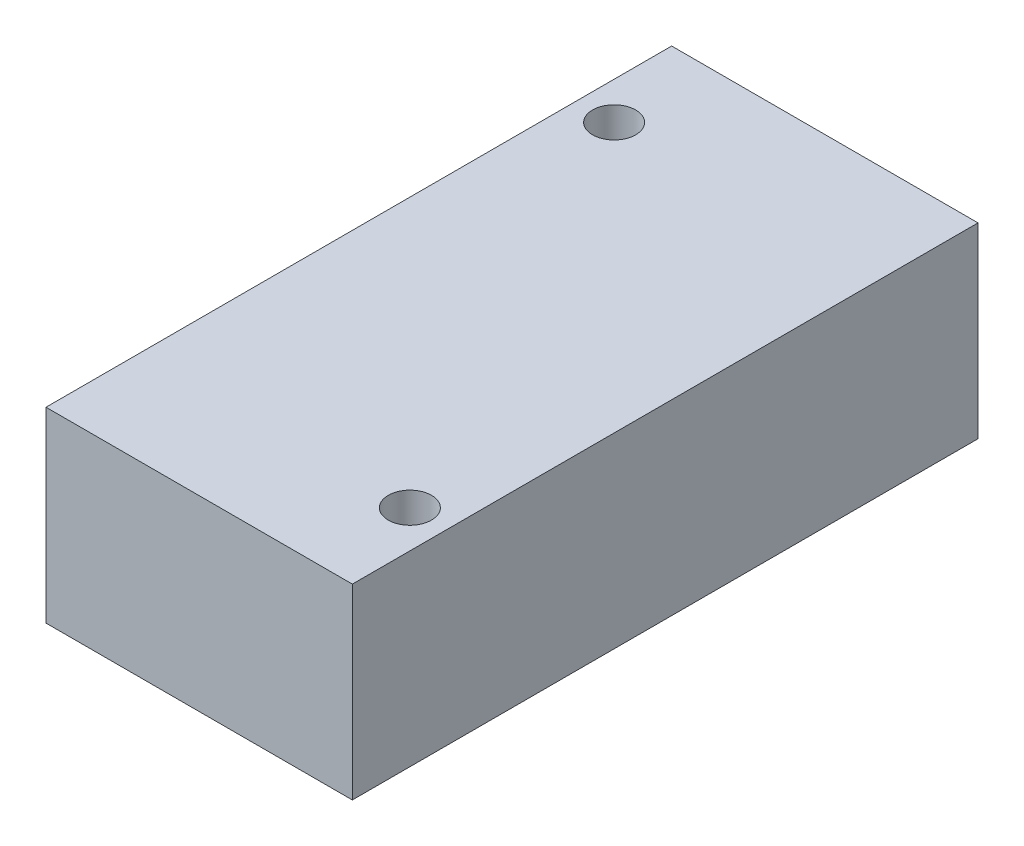
from build123d import *

# Parameters (mm, degrees)
SKETCH_1_W      = 21.3
SKETCH_1_H      = 43.5
SKETCH_1_R      = 1.5
EXTRUDE_1_DEPTH = 13


with BuildPart() as part:
    # 草图1 → 凸台-拉伸1 (new body)
    with BuildSketch(Plane(origin=(0, 0, 0), x_dir=(1, 0, 0), z_dir=(0, 1, 0))):
        Rectangle(SKETCH_1_W, SKETCH_1_H)
        with Locations(Location((-8.05, 15.15, 0), (0, 0, 90))):
            Circle(SKETCH_1_R, mode=Mode.SUBTRACT)
        with Locations(Location((8.05, -15.15, 0), (0, 0, 90))):
            Circle(SKETCH_1_R, mode=Mode.SUBTRACT)
    extrude(amount=EXTRUDE_1_DEPTH)


solid = part.part
